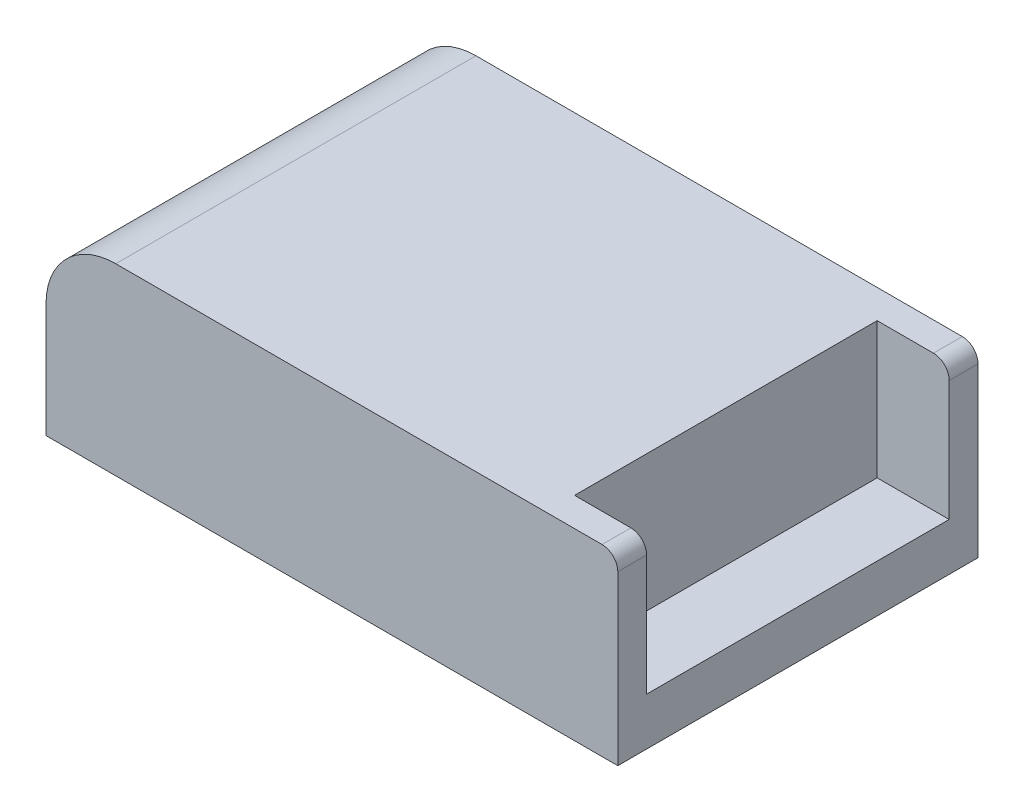
from build123d import *

# Parameters (mm, degrees)
BOSS_EXTRUDE1_DEPTH = 31.75
SCREWHEADNOTCH_W    = 6.35
SCREWHEADNOTCH_H    = 26.67
CUT_EXTRUDE1_DEPTH  = 12


with BuildPart() as part:
    # Sketch1 → Boss-Extrude1 (new body)
    with BuildSketch(Plane.XY):
        with BuildLine():
            Line((-91.391382579, -26.616972455), (-141.791382579, -26.616972455))
            Line((-141.791382579, -26.616972455), (-141.791382579, -16.574195588))
            ThreePointArc((-141.791382579, -16.574195588), (-140.786841742, -13.20570186), (-138.101382579, -10.937627484))
            ThreePointArc((-138.101382579, -10.937627484), (-136.897886888, -10.553921764), (-135.641382579, -10.424195588))
            Line((-135.641382579, -10.424195588), (-92.778882579, -10.424195588))
            ThreePointArc((-92.778882579, -10.424195588), (-91.79777192, -10.83058493), (-91.391382579, -11.811695588))
            Line((-91.391382579, -11.811695588), (-91.391382579, -26.616972455))
        make_face()
    extrude(amount=-BOSS_EXTRUDE1_DEPTH)

    # ScrewHeadNotch → Cut-Extrude1 (cut)
    with BuildSketch(Plane(origin=(0, -10.424195588, 0), x_dir=(1, 0, 0), z_dir=(0, 1, 0))):
        with Locations((-94.566382579, 15.875)):
            Rectangle(SCREWHEADNOTCH_W, SCREWHEADNOTCH_H)
    extrude(amount=-CUT_EXTRUDE1_DEPTH, mode=Mode.SUBTRACT)


solid = part.part
